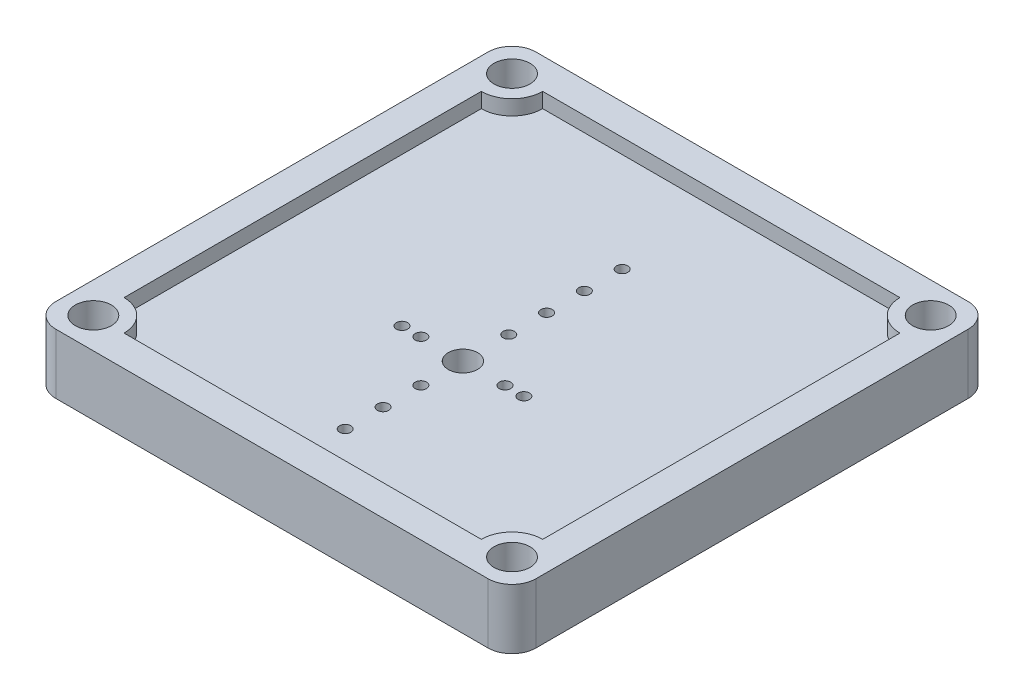
from build123d import *

# Parameters (mm, degrees)
SKETCH1_W           = 50.8
SKETCH1_H           = 50.8
SKETCH1_R           = 1.905
SKETCH1_R_2         = 0.6
SKETCH1_R_3         = 1.55
BOSS_EXTRUDE1_DEPTH = 6.35
CUT_EXTRUDE1_DEPTH  = 1.5875
CUT_EXTRUDE2_START  = 4.7625
CUT_EXTRUDE2_DEPTH  = 1.5875
FILLET1_R           = 2.54


with BuildPart() as part:
    # Sketch1 → Boss-Extrude1 (new body)
    with BuildSketch(Plane(origin=(0, 0, 0), x_dir=(1, 0, 0), z_dir=(0, 1, 0))):
        with Locations((25.4, 25.4)):
            Rectangle(SKETCH1_W, SKETCH1_H)
        with Locations(Location((3.251252547, 47.548747453, 0), (0, 0, 270))):
            Circle(SKETCH1_R, mode=Mode.SUBTRACT)
        with Locations(Location((3.251252547, 3.251252547, 0), (0, 0, 270))):
            Circle(SKETCH1_R, mode=Mode.SUBTRACT)
        with Locations(Location((47.548747453, 3.251252547, 0), (0, 0, 270))):
            Circle(SKETCH1_R, mode=Mode.SUBTRACT)
        with Locations(Location((47.548747453, 47.548747453, 0), (0, 0, 270))):
            Circle(SKETCH1_R, mode=Mode.SUBTRACT)
        with Locations(Location((25.404, 11.752, 0), (0, 0, 270))):
            Circle(SKETCH1_R_2, mode=Mode.SUBTRACT)
        with Locations(Location((18.954, 20.202, 0), (0, 0, 270))):
            Circle(SKETCH1_R_2, mode=Mode.SUBTRACT)
        with Locations(Location((20.954, 20.202, 0), (0, 0, 270))):
            Circle(SKETCH1_R_2, mode=Mode.SUBTRACT)
        with Locations(Location((31.854, 20.202, 0), (0, 0, 270))):
            Circle(SKETCH1_R_2, mode=Mode.SUBTRACT)
        with Locations(Location((29.854, 20.202, 0), (0, 0, 270))):
            Circle(SKETCH1_R_2, mode=Mode.SUBTRACT)
        with Locations(Location((25.404, 37.052, 0), (0, 0, 270))):
            Circle(SKETCH1_R_2, mode=Mode.SUBTRACT)
        with Locations(Location((25.404, 33.052, 0), (0, 0, 270))):
            Circle(SKETCH1_R_2, mode=Mode.SUBTRACT)
        with Locations(Location((25.404, 29.052, 0), (0, 0, 270))):
            Circle(SKETCH1_R_2, mode=Mode.SUBTRACT)
        with Locations(Location((25.404, 25.052, 0), (0, 0, 270))):
            Circle(SKETCH1_R_2, mode=Mode.SUBTRACT)
        with Locations(Location((25.404, 7.752, 0), (0, 0, 270))):
            Circle(SKETCH1_R_2, mode=Mode.SUBTRACT)
        with Locations(Location((25.404, 15.752, 0), (0, 0, 270))):
            Circle(SKETCH1_R_2, mode=Mode.SUBTRACT)
        with Locations(Location((25.404, 20.202, 0), (0, 0, 270))):
            Circle(SKETCH1_R_3, mode=Mode.SUBTRACT)
    extrude(amount=BOSS_EXTRUDE1_DEPTH)

    # Sketch2 → Cut-Extrude1 (cut)
    with BuildSketch(Plane(origin=(0, 0, 0), x_dir=(1, 0, 0), z_dir=(0, 1, 0))):
        with BuildLine():
            ThreePointArc((6.502505094, 47.548747453), (5.55023527, 45.24976473), (3.251252547, 44.297494906))
            Line((3.251252547, 44.297494906), (3.251252547, 6.502505094))
            ThreePointArc((3.251252547, 6.502505094), (5.55023527, 5.55023527), (6.502505094, 3.251252547))
            Line((6.502505094, 3.251252547), (44.297494906, 3.251252547))
            ThreePointArc((44.297494906, 3.251252547), (45.24976473, 5.55023527), (47.548747453, 6.502505094))
            Line((47.548747453, 6.502505094), (47.548747453, 44.297494906))
            ThreePointArc((47.548747453, 44.297494906), (45.24976473, 45.24976473), (44.297494906, 47.548747453))
            Line((44.297494906, 47.548747453), (6.502505094, 47.548747453))
        make_face()
    extrude(amount=CUT_EXTRUDE1_DEPTH, mode=Mode.SUBTRACT)

    # Sketch3 → Cut-Extrude2 (cut)
    with BuildSketch(Plane(origin=(0, 0, 0), x_dir=(1, 0, 0), z_dir=(0, 1, 0)).offset(CUT_EXTRUDE2_START)):
        with BuildLine():
            ThreePointArc((6.502505094, 47.548747453), (5.55023527, 45.24976473), (3.251252547, 44.297494906))
            Line((3.251252547, 44.297494906), (3.251252547, 6.502505094))
            ThreePointArc((3.251252547, 6.502505094), (5.55023527, 5.55023527), (6.502505094, 3.251252547))
            Line((6.502505094, 3.251252547), (44.297494906, 3.251252547))
            ThreePointArc((44.297494906, 3.251252547), (45.24976473, 5.55023527), (47.548747453, 6.502505094))
            Line((47.548747453, 6.502505094), (47.548747453, 44.297494906))
            ThreePointArc((47.548747453, 44.297494906), (45.24976473, 45.24976473), (44.297494906, 47.548747453))
            Line((44.297494906, 47.548747453), (6.502505094, 47.548747453))
        make_face()
    extrude(amount=CUT_EXTRUDE2_DEPTH, mode=Mode.SUBTRACT)

    # Fillet1
    fillet1_edges = [part.edges().sort_by_distance(p)[0] for p in [
        (50.8, 3.175, -50.8),
        (50.8, 3.175, 0),
        (0, 3.175, 0),
        (0, 3.175, -50.8),
    ]]
    fillet(fillet1_edges, radius=FILLET1_R)


solid = part.part
